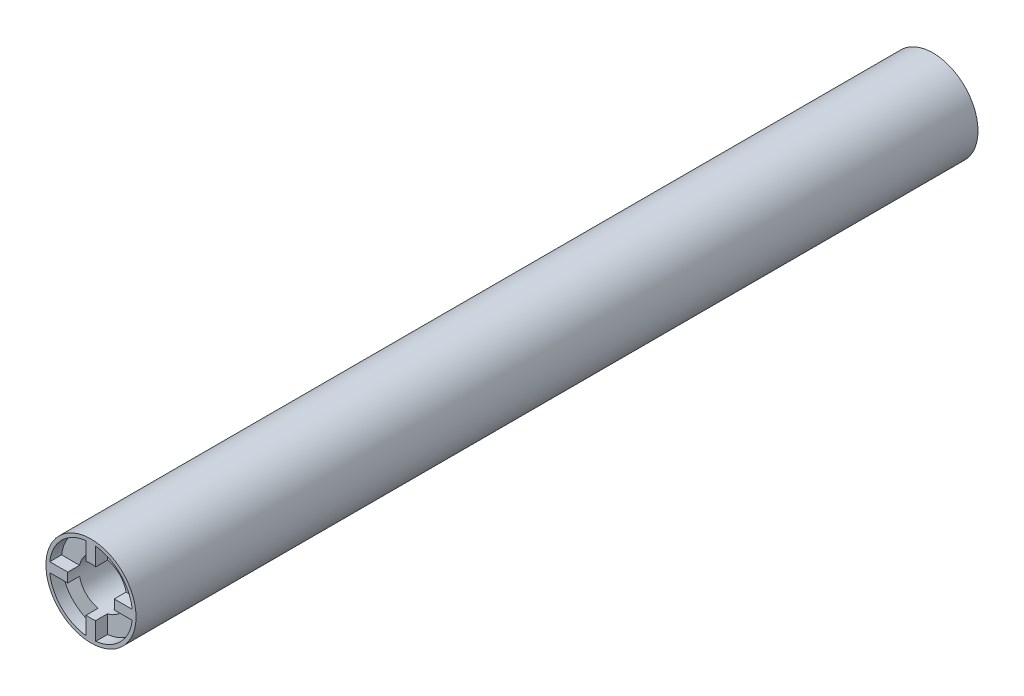
from build123d import *
from build123d.topology import SkipClean

# Parameters (mm, degrees)
SKETCH_1_R          = 1.9
EXTRUDE_1_DEPTH     = 35
SKETCH_3_R          = 1
CUT_EXTRUDE_1_DEPTH = 8
EXTRUDE_START       = 0.5
EXTRUDE_3_DEPTH     = 0.5


with BuildPart() as part:
    # 草图1 → 凸台-拉伸1 (new body)
    with BuildSketch(Plane.XY):
        Circle(SKETCH_1_R)
    extrude(amount=-EXTRUDE_1_DEPTH)

    # 草图3 → 切除-拉伸1 (cut)
    with BuildSketch(Plane.XY):
        Circle(SKETCH_3_R)
    extrude(amount=-CUT_EXTRUDE_1_DEPTH, mode=Mode.SUBTRACT)

    # 草图4 → 凸台-拉伸3 (add)
    with SkipClean():  # the faces are left unmerged after this step: merging them gives an invalid solid
        with BuildSketch(Plane.XY.offset(EXTRUDE_START)):
            with BuildLine():
                Line((-1.738533865, 0.2), (-1.889444363, 0.2))
                ThreePointArc((-1.889444363, 0.2), (-1.9, 0), (-1.889444363, -0.2))
                Line((-1.889444363, -0.2), (-1.738533865, -0.2))
                ThreePointArc((-1.738533865, -0.2), (-1.75, 0), (-1.738533865, 0.2))
            make_face()
            with BuildLine():
                ThreePointArc((1.9, 0), (1.897359256, 0.10013918), (1.889444363, 0.2))
                Line((1.889444363, 0.2), (1.738533865, 0.2))
                ThreePointArc((1.738533865, 0.2), (1.747131115, 0.100164205), (1.75, 0))
                ThreePointArc((1.75, 0), (1.747131115, -0.100164205), (1.738533865, -0.2))
                Line((1.738533865, -0.2), (1.889444363, -0.2))
                ThreePointArc((1.889444363, -0.2), (1.897359256, -0.10013918), (1.9, 0))
            make_face()
            with BuildLine():
                Line((0.2, -1.738533865), (0.2, -1.889444363))
                ThreePointArc((0.2, -1.889444363), (1.343502884, -1.343502884), (1.889444363, -0.2))
                Line((1.889444363, -0.2), (1.738533865, -0.2))
                ThreePointArc((1.738533865, -0.2), (1.237436867, -1.237436867), (0.2, -1.738533865))
            make_face()
            with BuildLine():
                Line((-0.2, -1.738533865), (-0.2, -1.889444363))
                ThreePointArc((-0.2, -1.889444363), (0, -1.9), (0.2, -1.889444363))
                Line((0.2, -1.889444363), (0.2, -1.738533865))
                ThreePointArc((0.2, -1.738533865), (0, -1.75), (-0.2, -1.738533865))
            make_face()
            with BuildLine():
                Line((-1.738533865, -0.2), (-1.889444363, -0.2))
                ThreePointArc((-1.889444363, -0.2), (-1.343502884, -1.343502884), (-0.2, -1.889444363))
                Line((-0.2, -1.889444363), (-0.2, -1.738533865))
                ThreePointArc((-0.2, -1.738533865), (-1.237436867, -1.237436867), (-1.738533865, -0.2))
            make_face()
            with BuildLine():
                ThreePointArc((-0.2, 1.889444363), (-1.343502884, 1.343502884), (-1.889444363, 0.2))
                Line((-1.889444363, 0.2), (-1.738533865, 0.2))
                ThreePointArc((-1.738533865, 0.2), (-1.237436867, 1.237436867), (-0.2, 1.738533865))
                Line((-0.2, 1.738533865), (-0.2, 1.889444363))
            make_face()
            with BuildLine():
                ThreePointArc((1.889444363, 0.2), (1.343502884, 1.343502884), (0.2, 1.889444363))
                Line((0.2, 1.889444363), (0.2, 1.738533865))
                ThreePointArc((0.2, 1.738533865), (1.237436867, 1.237436867), (1.738533865, 0.2))
                Line((1.738533865, 0.2), (1.889444363, 0.2))
            make_face()
            with BuildLine():
                ThreePointArc((0.2, 1.889444363), (0, 1.9), (-0.2, 1.889444363))
                Line((-0.2, 1.889444363), (-0.2, 1.738533865))
                ThreePointArc((-0.2, 1.738533865), (0, 1.75), (0.2, 1.738533865))
                Line((0.2, 1.738533865), (0.2, 1.889444363))
            make_face()
            with BuildLine():
                Line((-0.979795897, 0.2), (-1.738533865, 0.2))
                ThreePointArc((-1.738533865, 0.2), (-1.75, 0), (-1.738533865, -0.2))
                Line((-1.738533865, -0.2), (-0.979795897, -0.2))
                ThreePointArc((-0.979795897, -0.2), (-1, 0), (-0.979795897, 0.2))
            make_face()
            with BuildLine():
                ThreePointArc((1.75, 0), (1.747131115, 0.100164205), (1.738533865, 0.2))
                Line((1.738533865, 0.2), (0.979795897, 0.2))
                ThreePointArc((0.979795897, 0.2), (0.994936153, 0.100508962), (1, 0))
                ThreePointArc((1, 0), (0.994936153, -0.100508962), (0.979795897, -0.2))
                Line((0.979795897, -0.2), (1.738533865, -0.2))
                ThreePointArc((1.738533865, -0.2), (1.747131115, -0.100164205), (1.75, 0))
            make_face()
            with BuildLine():
                ThreePointArc((0.2, 1.738533865), (0, 1.75), (-0.2, 1.738533865))
                Line((-0.2, 1.738533865), (-0.2, 0.979795897))
                ThreePointArc((-0.2, 0.979795897), (0, 1), (0.2, 0.979795897))
                Line((0.2, 0.979795897), (0.2, 1.738533865))
            make_face()
            with BuildLine():
                Line((-0.2, -0.979795897), (-0.2, -1.738533865))
                ThreePointArc((-0.2, -1.738533865), (0, -1.75), (0.2, -1.738533865))
                Line((0.2, -1.738533865), (0.2, -0.979795897))
                ThreePointArc((0.2, -0.979795897), (0, -1), (-0.2, -0.979795897))
            make_face()
        extrude(amount=-EXTRUDE_3_DEPTH)


solid = part.part
